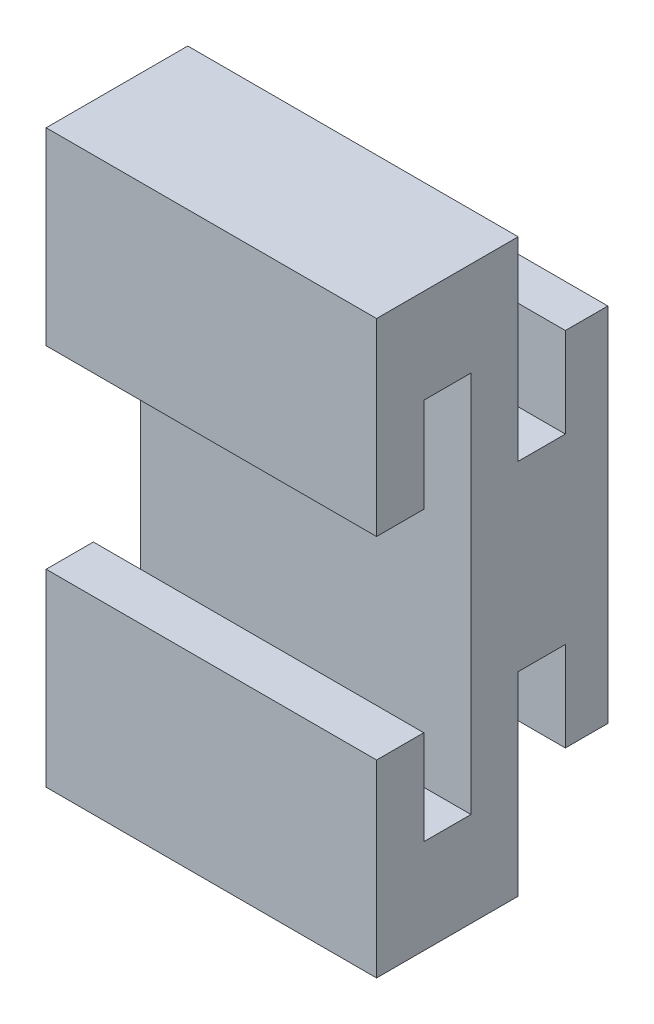
from build123d import *

# Parameters (mm, degrees)
SKETCH1_W           = 17.78
SKETCH1_H           = 30.734
BOSS_EXTRUDE1_DEPTH = 2.54
SKETCH2_W           = 17.78
SKETCH2_H           = 5.08
BOSS_EXTRUDE2_DEPTH = 5.08
SKETCH3_W           = 17.78
SKETCH3_H           = 2.54
BOSS_EXTRUDE3_DEPTH = 5.08
SKETCH4_W           = 17.78
SKETCH4_H           = 9.8044
BOSS_EXTRUDE4_DEPTH = 4.826
SKETCH5_W           = 17.78
SKETCH5_H           = 2.286
BOSS_EXTRUDE5_DEPTH = 4.826


with BuildPart() as part:
    # Sketch1 → Boss-Extrude1 (new body)
    with BuildSketch(Plane.XY):
        Rectangle(SKETCH1_W, SKETCH1_H)
    extrude(amount=BOSS_EXTRUDE1_DEPTH)

    # Sketch2 → Boss-Extrude2 (add)
    with BuildSketch(Plane.XY.offset(2.54)):
        with Locations((0, -12.827)):
            Rectangle(SKETCH2_W, SKETCH2_H)
    boss_extrude2 = extrude(amount=BOSS_EXTRUDE2_DEPTH)

    # Sketch3 → Boss-Extrude3 (add)
    with BuildSketch(Plane(origin=(0, -10.287, 0), x_dir=(1, 0, 0), z_dir=(0, 1, 0))):
        with Locations((0, -6.35)):
            Rectangle(SKETCH3_W, SKETCH3_H)
    boss_extrude3 = extrude(amount=BOSS_EXTRUDE3_DEPTH)

    # Mirror1: Boss-Extrude2, Boss-Extrude3 across plane
    add(boss_extrude2.mirror(Plane.ZX))
    add(boss_extrude3.mirror(Plane.ZX))

    # Sketch4 → Boss-Extrude4 (add)
    with BuildSketch(Plane(origin=(0, 0, 0), x_dir=(-1, 0, 0), z_dir=(0, 0, -1))):
        Rectangle(SKETCH4_W, SKETCH4_H)
    boss_extrude4 = extrude(amount=BOSS_EXTRUDE4_DEPTH)

    # Sketch5 → Boss-Extrude5 (add)
    with BuildSketch(Plane(origin=(0, 4.9022, 0), x_dir=(1, 0, 0), z_dir=(0, 1, 0))):
        with Locations((0, 3.683)):
            Rectangle(SKETCH5_W, SKETCH5_H)
    boss_extrude5 = extrude(amount=BOSS_EXTRUDE5_DEPTH)

    # Mirror2: Boss-Extrude4, Boss-Extrude5 across plane
    add(boss_extrude4.mirror(Plane.ZX))
    add(boss_extrude5.mirror(Plane.ZX))


solid = part.part
